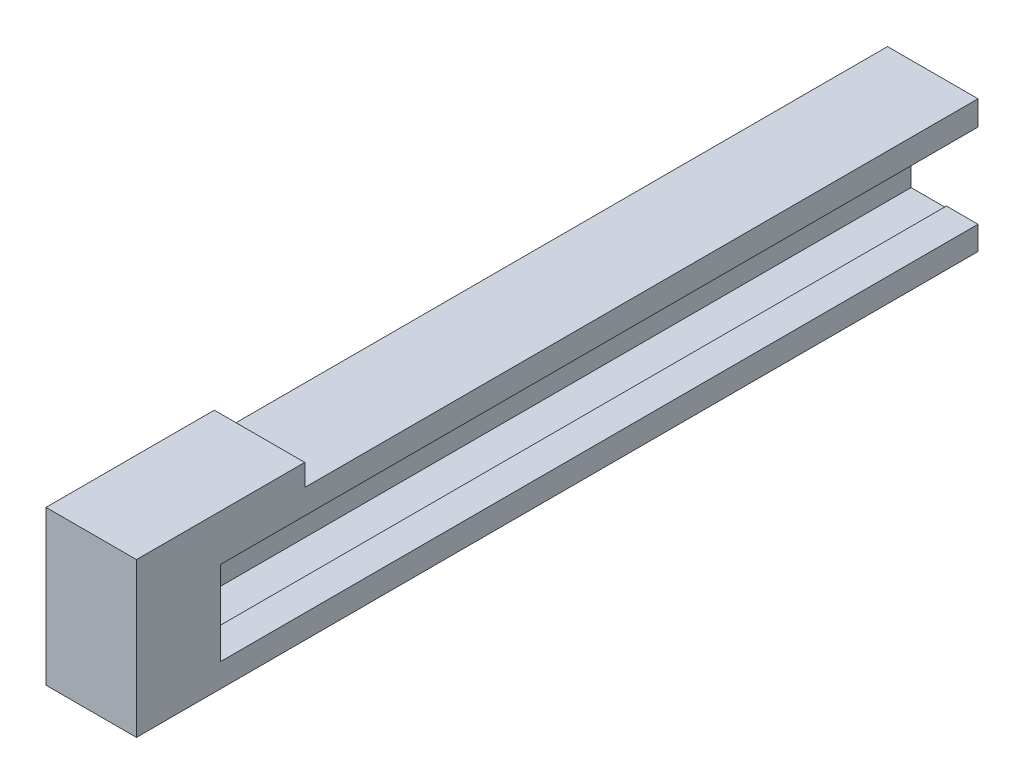
from build123d import *

# Parameters (mm, degrees)
SKETCH2_W           = 3.75
SKETCH2_H           = 0.3
SKETCH2_H_2         = 0.2
BOSS_EXTRUDE3_DEPTH = 90
SKETCH3_W           = 10.75
SKETCH3_H           = 15.726491146
BOSS_EXTRUDE4_DEPTH = 10
SKETCH4_W           = 10.75
SKETCH4_H           = 2.578461227
BOSS_EXTRUDE5_DEPTH = 20


with BuildPart() as part:
    # Sketch2 → Boss-Extrude3 (new body)
    with BuildSketch(Plane.XY):
        with Locations((14.875, 16.15)):
            Rectangle(SKETCH2_W, SKETCH2_H)
        Polygon((8.7, 16.3), (8.7, 18.913245573), (16.75, 18.913245573), (16.75, 16.3), (13, 16.3), align=None)
        Polygon((6, 18.913245573), (6, 13.8), (8.7, 13.8), (8.7, 16.3), (8.7, 18.913245573), align=None)
        Polygon((8.8, 3.186754427), (8.8, 5.8), (8.8, 8.3), (6, 8.3), (6, 3.186754427), align=None)
        Polygon((8.8, 5.8), (13, 5.8), (16.75, 5.8), (16.75, 3.186754427), (8.8, 3.186754427), align=None)
        with Locations((14.875, 5.9)):
            Rectangle(SKETCH2_W, SKETCH2_H_2)
    extrude(amount=BOSS_EXTRUDE3_DEPTH)

    # Sketch3 → Boss-Extrude4 (add)
    with BuildSketch(Plane.XY.offset(90)):
        with Locations((11.375, 11.05)):
            Rectangle(SKETCH3_W, SKETCH3_H)
    extrude(amount=BOSS_EXTRUDE4_DEPTH)

    # Sketch4 → Boss-Extrude5 (add)
    with BuildSketch(Plane.XY.offset(100)):
        with Locations((11.375, 20.202476187)):
            Rectangle(SKETCH4_W, SKETCH4_H)
    extrude(amount=-BOSS_EXTRUDE5_DEPTH)


solid = part.part
